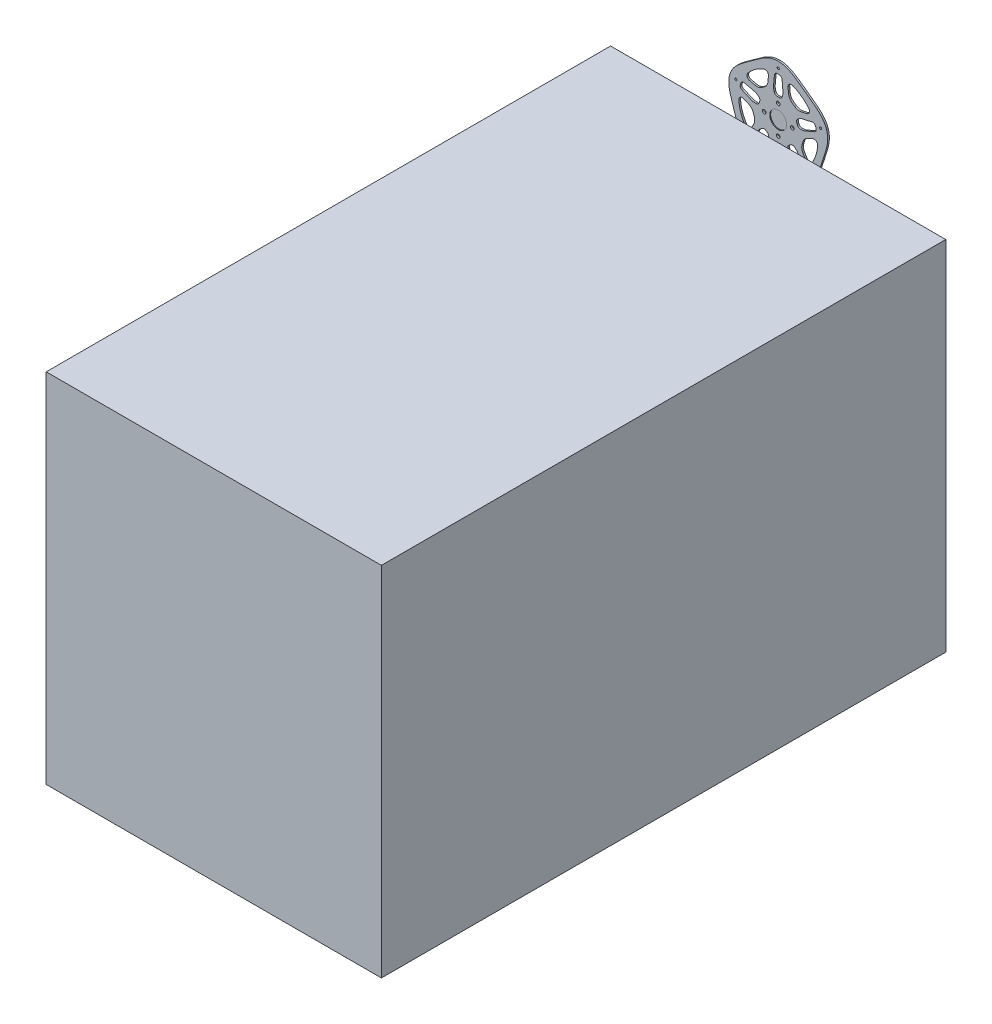
from build123d import *

# Parameters (mm, degrees)
SZKIC1_R                    = 3.2
SZKIC1_R_2                  = 1.9
DODANIE_WYCI_GNI_CIE1_DEPTH = 3
SZKIC2_R                    = 15
WYTNIJ_WYCI_GNI_CIE1_DEPTH  = 1.5
SZKIC3_W                    = 593.895792842
SZKIC3_H                    = 633.250333359
DODANIE_WYCI_GNI_CIE2_DEPTH = 1000


with BuildPart() as part:
    # Szkic1 → Dodanie-wyciągnięcie1 (new body)
    with BuildSketch(Plane.XY):
        with BuildLine():
            add(Edge.make_bspline(
                [(0, 90.000000009), (1.217332989, 89.99990734), (3.673322581, 89.885574936), (8.384242623, 89.238326941), (14.02387693, 87.720771792), (20.378150672, 85.018328924), (26.387520813, 81.676221472), (32.115008895, 77.919523903), (37.626541091, 73.960774633), (42.081531188, 70.670665496), (45.596565567, 68.138536648), (47.323168461, 66.936596905), (48.199232368, 66.340552012)],
                knots=[-4.177e-06, -4.177e-06, -4.177e-06, -4.177e-06, 0.062608961, 0.125222099, 0.250448375, 0.375674652, 0.500900928, 0.626127204, 0.75135348, 0.876579756, 0.939192894, 1.001806032, 1.001806032, 1.001806032, 1.001806032], degree=3))
            add(Edge.make_bspline(
                [(-48.199232368, 66.340552012), (-47.323168461, 66.936596905), (-45.596565567, 68.138536648), (-42.081531188, 70.670665496), (-37.626541091, 73.960774633), (-32.115008895, 77.919523903), (-26.387520813, 81.676221472), (-20.378150672, 85.018328924), (-14.02387693, 87.720771792), (-8.384242623, 89.238326941), (-3.673322581, 89.885574936), (-1.217332989, 89.99990734), (0, 90.000000009)],
                knots=[-4.177e-06, -4.177e-06, -4.177e-06, -4.177e-06, 0.062608961, 0.125222099, 0.250448375, 0.375674652, 0.500900928, 0.626127204, 0.75135348, 0.876579756, 0.939192894, 1.001806032, 1.001806032, 1.001806032, 1.001806032], degree=3))
            add(Edge.make_bspline(
                [(-85.595086475, 27.811529496), (-85.21882176, 28.969253332), (-84.35114266, 31.269707582), (-82.279818885, 35.550048155), (-79.093795329, 40.444708781), (-74.560040856, 45.652881458), (-69.524510286, 50.335364089), (-64.181787432, 54.62164556), (-58.713636028, 58.640103368), (-54.207888645, 61.860351094), (-50.713485644, 64.420876599), (-49.036823383, 65.691553726), (-48.199232368, 66.340552012)],
                knots=[-4.177e-06, -4.177e-06, -4.177e-06, -4.177e-06, 0.062608961, 0.125222099, 0.250448375, 0.375674652, 0.500900928, 0.626127204, 0.75135348, 0.876579756, 0.939192894, 1.001806032, 1.001806032, 1.001806032, 1.001806032], degree=3))
            add(Edge.make_bspline(
                [(-77.987996204, -25.339836036), (-78.284149947, -24.322461747), (-78.893712935, -22.308945007), (-80.215705218, -18.18347781), (-81.968117301, -12.929830811), (-84.029954478, -6.464731401), (-85.832895028, 0.143316853), (-87.1544306, 6.891335484), (-87.761027926, 13.769709705), (-87.461565796, 19.602270993), (-86.621380867, 24.282632827), (-85.971174923, 26.653748388), (-85.595086475, 27.811529496)],
                knots=[-4.177e-06, -4.177e-06, -4.177e-06, -4.177e-06, 0.062608961, 0.125222099, 0.250448375, 0.375674652, 0.500900928, 0.626127204, 0.75135348, 0.876579756, 0.939192894, 1.001806032, 1.001806032, 1.001806032, 1.001806032], degree=3))
            add(Edge.make_bspline(
                [(-52.900672711, -72.811529501), (-53.885461318, -72.095924152), (-55.805195735, -70.559832832), (-59.235967282, -67.267188879), (-62.906530743, -62.7245671), (-66.458790124, -56.803296499), (-69.356031221, -50.567255628), (-71.781534986, -44.161490426), (-73.913563759, -37.719197647), (-75.583848829, -32.438865964), (-76.939223383, -28.324245324), (-77.629592012, -26.336983929), (-77.987996204, -25.339836036)],
                knots=[-4.177e-06, -4.177e-06, -4.177e-06, -4.177e-06, 0.062608961, 0.125222099, 0.250448375, 0.375674652, 0.500900928, 0.626127204, 0.75135348, 0.876579756, 0.939192894, 1.001806032, 1.001806032, 1.001806032, 1.001806032], degree=3))
            add(Edge.make_bspline(
                [(0, -82.001431952), (-1.059096987, -81.968704955), (-3.162430526, -81.926222915), (-7.494501068, -81.908672817), (-13.032541395, -81.951849543), (-19.818359046, -81.914947637), (-26.660125667, -81.587646786), (-33.486249708, -80.759249367), (-40.215421216, -79.210623179), (-45.669977748, -77.123457211), (-49.861634947, -74.878082513), (-51.915775166, -73.526984909), (-52.900672711, -72.811529501)],
                knots=[-4.177e-06, -4.177e-06, -4.177e-06, -4.177e-06, 0.062608961, 0.125222099, 0.250448375, 0.375674652, 0.500900928, 0.626127204, 0.75135348, 0.876579756, 0.939192894, 1.001806032, 1.001806032, 1.001806032, 1.001806032], degree=3))
            add(Edge.make_bspline(
                [(52.900672711, -72.811529501), (51.915775166, -73.526984909), (49.861634947, -74.878082513), (45.669977748, -77.123457211), (40.215421216, -79.210623179), (33.486249708, -80.759249367), (26.660125667, -81.587646786), (19.818359046, -81.914947637), (13.032541395, -81.951849543), (7.494501068, -81.908672817), (3.162430526, -81.926222915), (1.059096987, -81.968704955), (0, -82.001431952)],
                knots=[-4.177e-06, -4.177e-06, -4.177e-06, -4.177e-06, 0.062608961, 0.125222099, 0.250448375, 0.375674652, 0.500900928, 0.626127204, 0.75135348, 0.876579756, 0.939192894, 1.001806032, 1.001806032, 1.001806032, 1.001806032], degree=3))
            add(Edge.make_bspline(
                [(77.987996204, -25.339836036), (77.629592012, -26.336983929), (76.939223383, -28.324245324), (75.583848829, -32.438865964), (73.913563759, -37.719197647), (71.781534986, -44.161490426), (69.356031221, -50.567255628), (66.458790124, -56.803296499), (62.906530743, -62.7245671), (59.235967282, -67.267188879), (55.805195735, -70.559832832), (53.885461318, -72.095924152), (52.900672711, -72.811529501)],
                knots=[-4.177e-06, -4.177e-06, -4.177e-06, -4.177e-06, 0.062608961, 0.125222099, 0.250448375, 0.375674652, 0.500900928, 0.626127204, 0.75135348, 0.876579756, 0.939192894, 1.001806032, 1.001806032, 1.001806032, 1.001806032], degree=3))
            add(Edge.make_bspline(
                [(85.595086475, 27.811529496), (85.971174923, 26.653748388), (86.621380867, 24.282632827), (87.461565796, 19.602270993), (87.761027926, 13.769709705), (87.1544306, 6.891335484), (85.832895028, 0.143316853), (84.029954478, -6.464731401), (81.968117301, -12.929830811), (80.215705218, -18.18347781), (78.893712935, -22.308945007), (78.284149947, -24.322461747), (77.987996204, -25.339836036)],
                knots=[-4.177e-06, -4.177e-06, -4.177e-06, -4.177e-06, 0.062608961, 0.125222099, 0.250448375, 0.375674652, 0.500900928, 0.626127204, 0.75135348, 0.876579756, 0.939192894, 1.001806032, 1.001806032, 1.001806032, 1.001806032], degree=3))
            add(Edge.make_bspline(
                [(48.199232368, 66.340552012), (49.036823383, 65.691553726), (50.713485644, 64.420876599), (54.207888645, 61.860351094), (58.713636028, 58.640103368), (64.181787432, 54.62164556), (69.524510286, 50.335364089), (74.560040856, 45.652881458), (79.093795329, 40.444708781), (82.279818885, 35.550048155), (84.35114266, 31.269707582), (85.21882176, 28.969253332), (85.595086475, 27.811529496)],
                knots=[-4.177e-06, -4.177e-06, -4.177e-06, -4.177e-06, 0.062608961, 0.125222099, 0.250448375, 0.375674652, 0.500900928, 0.626127204, 0.75135348, 0.876579756, 0.939192894, 1.001806032, 1.001806032, 1.001806032, 1.001806032], degree=3))
        make_face()
        with BuildLine():
            ThreePointArc((54.081819728, 44.442735907), (55.126338057, 38.700373469), (50.795941506, 34.787138155))
            Line((50.795941506, 34.787138155), (41.307144276, 32.596476703))
            ThreePointArc((41.307144276, 32.596476703), (41.292145788, 32.593005921), (41.277150869, 32.589519748))
            ThreePointArc((41.277150869, 32.589519748), (34.897459984, 32.4961817), (29.056112863, 35.062858849))
            Line((29.056112863, 35.062858849), (24.367927723, 38.469024732))
            ThreePointArc((24.367927723, 38.469024732), (20.121797165, 43.231329118), (18.239134021, 49.327618749))
            ThreePointArc((18.239134021, 49.327618749), (18.237815884, 49.342957051), (18.236482006, 49.358293991))
            Line((18.236482006, 49.358293991), (17.387725255, 59.059628046))
            ThreePointArc((17.387725255, 59.059628046), (19.771267073, 64.387336119), (25.555352204, 65.168427737))
            ThreePointArc((25.555352204, 65.168427737), (41.14496766, 56.631189606), (54.081819728, 44.442735907))
        make_face(mode=Mode.SUBTRACT)
        with BuildLine():
            ThreePointArc((60.109644149, 26.674334759), (63.635583789, 26.188178637), (65.944737838, 23.479598623))
            ThreePointArc((65.944737838, 23.479598623), (66.573956141, 21.631189606), (67.151375401, 19.765950061))
            ThreePointArc((67.151375401, 19.765950061), (66.875293919, 16.217376103), (64.308504229, 13.751572218))
            Line((64.308504229, 13.751572218), (46.909382225, 6.366083103))
            ThreePointArc((46.909382225, 6.366083103), (45.350075076, 5.850695609), (43.727440774, 5.597474404))
            Line((43.727440774, 5.597474404), (39.847424773, 5.315286387))
            ThreePointArc((39.847424773, 5.315286387), (35.977494902, 6.37984851), (33.644563428, 9.645898182))
            ThreePointArc((33.644563428, 9.645898182), (33.28697807, 10.815594803), (32.888740278, 11.972082648))
            ThreePointArc((32.888740278, 11.972082648), (32.856385657, 15.985635052), (35.361490774, 19.121571606))
            Line((35.361490774, 19.121571606), (38.666355612, 21.173892889))
            ThreePointArc((38.666355612, 21.173892889), (40.127934027, 21.922793143), (41.692377179, 22.422373648))
            Line((41.692377179, 22.422373648), (60.109644149, 26.674334759))
        make_face(mode=Mode.SUBTRACT)
        with BuildLine():
            ThreePointArc((1.952380588, 69.972767632), (5.241961105, 68.613628881), (6.793898323, 65.410491515))
            Line((6.793898323, 65.410491515), (8.441291485, 46.580701507))
            ThreePointArc((8.441291485, 46.580701507), (8.44960171, 44.938448787), (8.189007813, 43.316982206))
            Line((8.189007813, 43.316982206), (7.258393683, 39.539666812))
            ThreePointArc((7.258393683, 39.539666812), (5.050060842, 36.188112577), (1.222947547, 34.97862775))
            ThreePointArc((1.222947547, 34.97862775), (0, 35), (-1.222947547, 34.97862775))
            ThreePointArc((-1.222947547, 34.97862775), (-5.050060842, 36.188112577), (-7.258393683, 39.539666812))
            Line((-7.258393683, 39.539666812), (-8.189007813, 43.316982206))
            ThreePointArc((-8.189007813, 43.316982206), (-8.44960171, 44.938448787), (-8.441291485, 46.580701507))
            Line((-8.441291485, 46.580701507), (-6.793898323, 65.410491515))
            ThreePointArc((-6.793898323, 65.410491515), (-5.241961105, 68.613628881), (-1.952380588, 69.972767632))
            ThreePointArc((-1.952380588, 69.972767632), (0, 70), (1.952380588, 69.972767632))
        make_face(mode=Mode.SUBTRACT)
        with BuildLine():
            ThreePointArc((61.542146701, 1.71371934), (67.345653109, 1.093188698), (69.875895984, -4.166432572))
            ThreePointArc((69.875895984, -4.166432572), (66.573956141, -21.631189606), (58.979754969, -37.701306393))
            ThreePointArc((58.979754969, -37.701306393), (53.841217668, -40.469189938), (48.781343596, -37.559994295))
            Line((48.781343596, -37.559994295), (43.765701147, -29.212563476))
            ThreePointArc((43.765701147, -29.212563476), (43.757765449, -29.199371596), (43.749816217, -29.186187868))
            ThreePointArc((43.749816217, -29.186187868), (41.689613557, -23.147584323), (42.325593053, -16.798986221))
            Line((42.325593053, -16.798986221), (44.116320431, -11.28769405))
            ThreePointArc((44.116320431, -11.28769405), (47.333414547, -5.777750927), (52.54955562, -2.103374777))
            ThreePointArc((52.54955562, -2.103374777), (52.563735885, -2.097381358), (52.577909991, -2.091373389))
            Line((52.577909991, -2.091373389), (61.542146701, 1.71371934))
        make_face(mode=Mode.SUBTRACT)
        with BuildLine():
            ThreePointArc((-25.555352204, 65.168427737), (-19.771267073, 64.387336119), (-17.387725255, 59.059628046))
            Line((-17.387725255, 59.059628046), (-18.236482006, 49.358293991))
            ThreePointArc((-18.236482006, 49.358293991), (-18.237815884, 49.342957051), (-18.239134021, 49.327618749))
            ThreePointArc((-18.239134021, 49.327618749), (-20.121797165, 43.231329118), (-24.367927723, 38.469024732))
            Line((-24.367927723, 38.469024732), (-29.056112863, 35.062858849))
            ThreePointArc((-29.056112863, 35.062858849), (-34.897459984, 32.4961817), (-41.277150869, 32.589519748))
            ThreePointArc((-41.277150869, 32.589519748), (-41.292145788, 32.593005921), (-41.307144276, 32.596476703))
            Line((-41.307144276, 32.596476703), (-50.795941506, 34.787138155))
            ThreePointArc((-50.795941506, 34.787138155), (-55.126338057, 38.700373469), (-54.081819728, 44.442735907))
            ThreePointArc((-54.081819728, 44.442735907), (-41.14496766, 56.631189606), (-25.555352204, 65.168427737))
        make_face(mode=Mode.SUBTRACT)
        with BuildLine():
            ThreePointArc((43.943701458, -48.924846006), (44.57091478, -52.42844438), (42.708469952, -55.461577641))
            ThreePointArc((42.708469951, -55.461577641), (41.14496766, -56.631189606), (39.549451801, -57.756738674))
            ThreePointArc((39.549451801, -57.756738674), (36.089243545, -58.590739241), (32.950943057, -56.911552485))
            Line((32.950943057, -56.911552485), (20.550301122, -42.646245774))
            ThreePointArc((20.550301122, -42.646245774), (19.578286079, -41.322520043), (18.836036827, -39.857552772))
            Line((18.836036827, -39.857552772), (17.368669191, -36.254639165))
            ThreePointArc((17.368669191, -36.254639165), (17.185253838, -32.245149355), (19.570536189, -29.017134822))
            ThreePointArc((19.570536189, -29.017134822), (20.57248383, -28.315594803), (21.549306886, -27.579473758))
            ThreePointArc((21.549306886, -27.579473758), (25.356423925, -26.308446784), (29.112996874, -27.721885641))
            Line((29.112996874, -27.721885641), (32.086129802, -30.230796726))
            ThreePointArc((32.086129802, -30.230796726), (33.250028838, -31.389417497), (34.208597653, -32.722912484))
            Line((34.208597653, -32.722912484), (43.943701458, -48.924846006))
        make_face(mode=Mode.SUBTRACT)
        with BuildLine():
            ThreePointArc((-65.944737838, 23.479598622), (-63.635583789, 26.188178637), (-60.109644149, 26.674334759))
            Line((-60.109644149, 26.674334759), (-41.692377179, 22.422373648))
            ThreePointArc((-41.692377179, 22.422373648), (-40.127934027, 21.922793143), (-38.666355612, 21.173892889))
            Line((-38.666355612, 21.173892889), (-35.361490774, 19.121571606))
            ThreePointArc((-35.361490774, 19.121571606), (-32.856385657, 15.985635052), (-32.888740278, 11.972082648))
            ThreePointArc((-32.888740278, 11.972082648), (-33.28697807, 10.815594803), (-33.644563428, 9.645898182))
            ThreePointArc((-33.644563428, 9.645898182), (-35.977494902, 6.37984851), (-39.847424773, 5.315286387))
            Line((-39.847424773, 5.315286387), (-43.727440774, 5.597474404))
            ThreePointArc((-43.727440774, 5.597474404), (-45.350075076, 5.850695609), (-46.909382225, 6.366083103))
            Line((-46.909382225, 6.366083103), (-64.308504229, 13.751572218))
            ThreePointArc((-64.308504229, 13.751572218), (-66.875293919, 16.217376103), (-67.151375401, 19.765950061))
            ThreePointArc((-67.151375401, 19.765950061), (-66.573956141, 21.631189606), (-65.944737838, 23.479598623))
        make_face(mode=Mode.SUBTRACT)
        with BuildLine():
            ThreePointArc((20.647413147, -58.000491247), (21.850635543, -63.711708348), (17.630326509, -67.743424679))
            ThreePointArc((17.630326509, -67.743424679), (0, -70), (-17.630326509, -67.743424679))
            ThreePointArc((-17.630326509, -67.743424679), (-21.850635543, -63.711708348), (-20.647413146, -58.000491247))
            Line((-20.647413146, -58.000491247), (-14.258453426, -50.650833829))
            ThreePointArc((-14.258453426, -50.650833829), (-14.248359468, -50.639210017), (-14.238277446, -50.627575852))
            ThreePointArc((-14.238277446, -50.627575852), (-9.131861829, -46.802175569), (-2.897457762, -45.44520331))
            Line((-2.897457762, -45.44520331), (2.897457762, -45.44520331))
            ThreePointArc((2.897457762, -45.44520331), (9.131861829, -46.802175569), (14.238277446, -50.627575852))
            ThreePointArc((14.238277446, -50.627575852), (14.248359468, -50.639210017), (14.258453426, -50.650833829))
            Line((14.258453426, -50.650833829), (20.647413146, -58.000491247))
        make_face(mode=Mode.SUBTRACT)
        with BuildLine():
            ThreePointArc((-69.875895984, -4.166432572), (-67.345653109, 1.093188698), (-61.5421467, 1.71371934))
            Line((-61.5421467, 1.71371934), (-52.577909991, -2.091373389))
            ThreePointArc((-52.577909991, -2.091373389), (-52.563735885, -2.097381358), (-52.54955562, -2.103374777))
            ThreePointArc((-52.54955562, -2.103374777), (-47.333414547, -5.777750927), (-44.116320431, -11.28769405))
            Line((-44.116320431, -11.28769405), (-42.325593053, -16.798986221))
            ThreePointArc((-42.325593053, -16.798986221), (-41.689613557, -23.147584323), (-43.749816217, -29.186187868))
            ThreePointArc((-43.749816217, -29.186187868), (-43.757765449, -29.199371596), (-43.765701147, -29.212563476))
            Line((-43.765701147, -29.212563476), (-48.781343596, -37.559994295))
            ThreePointArc((-48.781343596, -37.559994295), (-53.841217668, -40.469189938), (-58.979754969, -37.701306393))
            ThreePointArc((-58.979754969, -37.701306393), (-66.573956141, -21.631189606), (-69.875895984, -4.166432572))
        make_face(mode=Mode.SUBTRACT)
        with BuildLine():
            ThreePointArc((-32.950943056, -56.911552485), (-36.089243545, -58.590739241), (-39.5494518, -57.756738674))
            ThreePointArc((-39.5494518, -57.756738674), (-41.14496766, -56.631189606), (-42.708469951, -55.461577641))
            ThreePointArc((-42.708469951, -55.461577641), (-44.57091478, -52.42844438), (-43.943701458, -48.924846006))
            Line((-43.943701458, -48.924846006), (-34.208597653, -32.722912484))
            ThreePointArc((-34.208597653, -32.722912484), (-33.250028838, -31.389417497), (-32.086129802, -30.230796726))
            Line((-32.086129802, -30.230796726), (-29.112996874, -27.721885641))
            ThreePointArc((-29.112996874, -27.721885641), (-25.356423925, -26.308446784), (-21.549306886, -27.579473758))
            ThreePointArc((-21.549306886, -27.579473758), (-20.57248383, -28.315594803), (-19.570536189, -29.017134822))
            ThreePointArc((-19.570536189, -29.017134822), (-17.185253838, -32.245149355), (-17.368669191, -36.254639165))
            Line((-17.368669191, -36.254639165), (-18.836036827, -39.857552772))
            ThreePointArc((-18.836036827, -39.857552772), (-19.578286079, -41.322520043), (-20.550301122, -42.646245774))
            Line((-20.550301122, -42.646245774), (-32.950943056, -56.911552485))
        make_face(mode=Mode.SUBTRACT)
        with Locations((-25, 0)):
            Circle(SZKIC1_R, mode=Mode.SUBTRACT)
        with Locations((0, -25)):
            Circle(SZKIC1_R, mode=Mode.SUBTRACT)
        with Locations((25, 0)):
            Circle(SZKIC1_R, mode=Mode.SUBTRACT)
        with Locations((0, 25)):
            Circle(SZKIC1_R, mode=Mode.SUBTRACT)
        with Locations((-46.435034931, -63.912342556)):
            Circle(SZKIC1_R_2, mode=Mode.SUBTRACT)
        with Locations((75.133464787, 24.412342556)):
            Circle(SZKIC1_R_2, mode=Mode.SUBTRACT)
        with Locations((-75.133464787, 24.412342556)):
            Circle(SZKIC1_R_2, mode=Mode.SUBTRACT)
        with Locations((0, 79)):
            Circle(SZKIC1_R_2, mode=Mode.SUBTRACT)
        with Locations((46.435034931, -63.912342556)):
            Circle(SZKIC1_R_2, mode=Mode.SUBTRACT)
    extrude(amount=DODANIE_WYCI_GNI_CIE1_DEPTH)

    # Szkic2 → Wytnij-wyciągnięcie1 (cut)
    with BuildSketch(Plane.XY.offset(3)):
        Circle(SZKIC2_R)
    extrude(amount=-WYTNIJ_WYCI_GNI_CIE1_DEPTH, mode=Mode.SUBTRACT)


with BuildPart() as body_2:
    # Szkic3 → Dodanie-wyciągnięcie2 (new body)
    with BuildSketch(Plane.XY.offset(3.1)):
        with Locations((0, -351.831352914)):
            Rectangle(SZKIC3_W, SZKIC3_H)
    extrude(amount=DODANIE_WYCI_GNI_CIE2_DEPTH)


solid = Compound([part.part, body_2.part])
